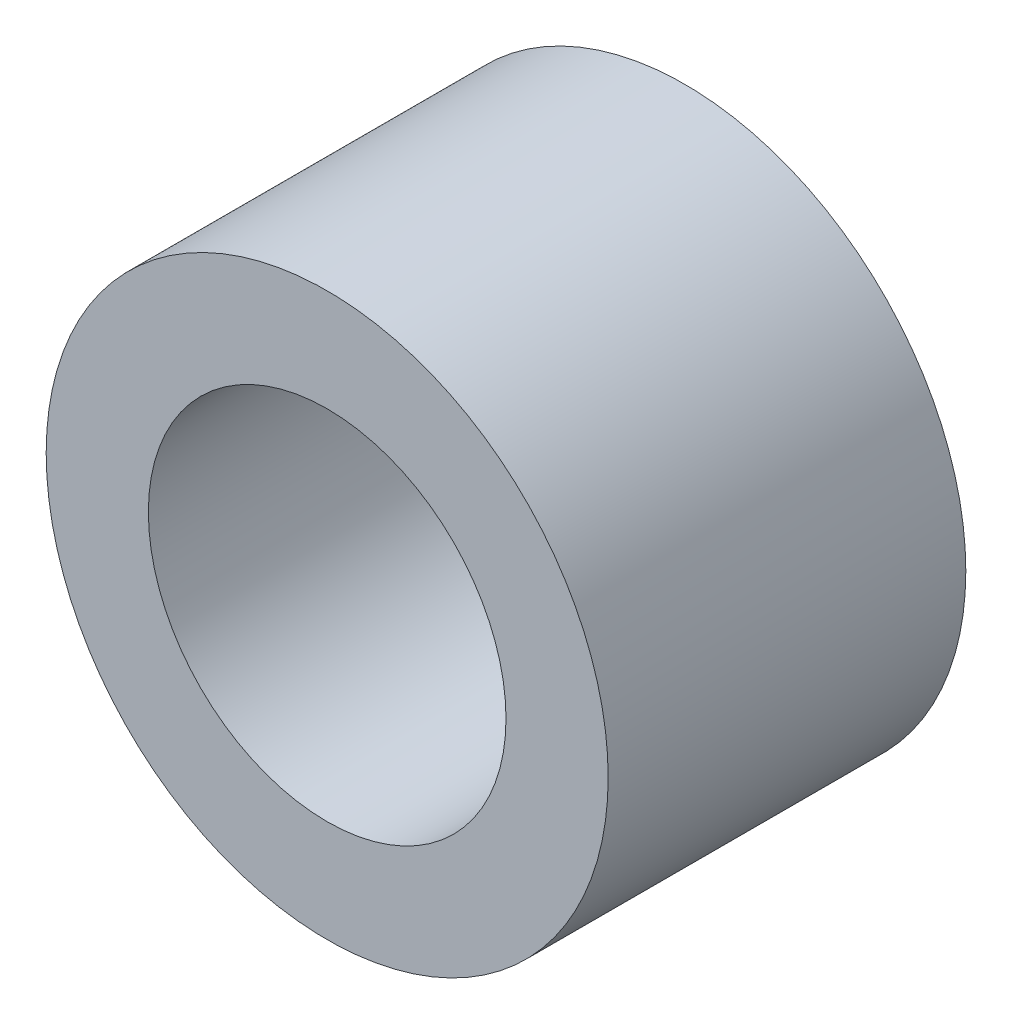
from build123d import *

# Parameters (mm, degrees)
SKETCH_1_R      = 2.75
SKETCH_1_R_2    = 1.75
EXTRUDE_1_DEPTH = 3.5


with BuildPart() as part:
    # 草图1 → 凸台-拉伸1 (new body)
    with BuildSketch(Plane.XY):
        Circle(SKETCH_1_R)
        Circle(SKETCH_1_R_2, mode=Mode.SUBTRACT)
    extrude(amount=EXTRUDE_1_DEPTH)


solid = part.part
